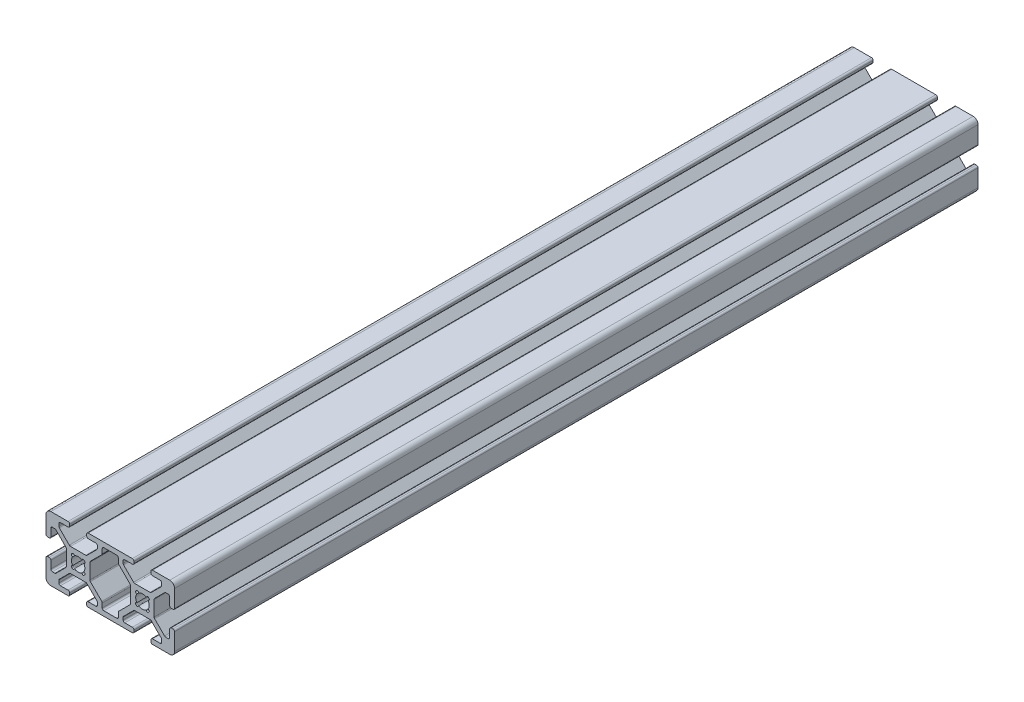
from build123d import *

# Parameters (mm, degrees)
BOSS_EXTRUDE1_DEPTH = 125


with BuildPart() as part:
    # Sketch1 → Boss-Extrude1 (new, symmetric)
    with BuildSketch(Plane.XY):
        with BuildLine():
            Line((-20, 8.5), (-20, 3.138))
            ThreePointArc((-20, 3.138), (-19.851210245, 2.778789755), (-19.492, 2.63))
            Line((-19.492, 2.63), (-19.008, 2.63))
            ThreePointArc((-19.008, 2.63), (-18.648789755, 2.778789755), (-18.5, 3.138))
            Line((-18.5, 3.138), (-18.5, 5.487))
            ThreePointArc((-18.5, 5.487), (-18.351210245, 5.846210245), (-17.992, 5.995))
            Line((-17.992, 5.995), (-17.266080661, 5.995))
            ThreePointArc((-17.266080661, 5.995), (-17.071677478, 5.956330803), (-16.906870417, 5.846210245))
            Line((-16.906870417, 5.846210245), (-13.803789755, 2.743129583))
            ThreePointArc((-13.803789755, 2.743129583), (-13.693669197, 2.578322522), (-13.655, 2.383919339))
            Line((-13.655, 2.383919339), (-13.655, -2.383919339))
            ThreePointArc((-13.655, -2.383919339), (-13.693669197, -2.578322522), (-13.803789755, -2.743129583))
            Line((-13.803789755, -2.743129583), (-16.906870417, -5.846210245))
            ThreePointArc((-16.906870417, -5.846210245), (-17.071677478, -5.956330803), (-17.266080661, -5.995))
            Line((-17.266080661, -5.995), (-17.992, -5.995))
            ThreePointArc((-17.992, -5.995), (-18.351210245, -5.846210245), (-18.5, -5.487))
            Line((-18.5, -5.487), (-18.5, -3.138))
            ThreePointArc((-18.5, -3.138), (-18.648789755, -2.778789755), (-19.008, -2.63))
            Line((-19.008, -2.63), (-19.492, -2.63))
            ThreePointArc((-19.492, -2.63), (-19.851210245, -2.778789755), (-20, -3.138))
            Line((-20, -3.138), (-20, -8.5))
            ThreePointArc((-20, -8.5), (-19.560660172, -9.560660172), (-18.5, -10))
            Line((-18.5, -10), (-13.138, -10))
            ThreePointArc((-13.138, -10), (-12.778789755, -9.851210245), (-12.63, -9.492))
            Line((-12.63, -9.492), (-12.63, -9.008))
            ThreePointArc((-12.63, -9.008), (-12.778789755, -8.648789755), (-13.138, -8.5))
            Line((-13.138, -8.5), (-15.487, -8.5))
            ThreePointArc((-15.487, -8.5), (-15.846210245, -8.351210245), (-15.995, -7.992))
            Line((-15.995, -7.992), (-15.995, -7.266080661))
            ThreePointArc((-15.995, -7.266080661), (-15.956330803, -7.071677478), (-15.846210245, -6.906870417))
            Line((-15.846210245, -6.906870417), (-12.743129583, -3.803789755))
            ThreePointArc((-12.743129583, -3.803789755), (-12.578322522, -3.693669197), (-12.383919339, -3.655))
            Line((-12.383919339, -3.655), (-7.616080661, -3.655))
            ThreePointArc((-7.616080661, -3.655), (-7.421677478, -3.693669197), (-7.256870417, -3.803789755))
            Line((-7.256870417, -3.803789755), (-4.153789755, -6.906870417))
            ThreePointArc((-4.153789755, -6.906870417), (-4.043669197, -7.071677478), (-4.005, -7.266080661))
            Line((-4.005, -7.266080661), (-4.005, -7.992))
            ThreePointArc((-4.005, -7.992), (-4.153789755, -8.351210245), (-4.513, -8.5))
            Line((-4.513, -8.5), (-6.862, -8.5))
            ThreePointArc((-6.862, -8.5), (-7.221210245, -8.648789755), (-7.37, -9.008))
            Line((-7.37, -9.008), (-7.37, -9.492))
            ThreePointArc((-7.37, -9.492), (-7.221210245, -9.851210245), (-6.862, -10))
            Line((-6.862, -10), (6.862, -10))
            ThreePointArc((6.862, -10), (7.221210245, -9.851210245), (7.37, -9.492))
            Line((7.37, -9.492), (7.37, -9.008))
            ThreePointArc((7.37, -9.008), (7.221210245, -8.648789755), (6.862, -8.5))
            Line((6.862, -8.5), (4.513, -8.5))
            ThreePointArc((4.513, -8.5), (4.153789755, -8.351210245), (4.005, -7.992))
            Line((4.005, -7.992), (4.005, -7.266080661))
            ThreePointArc((4.005, -7.266080661), (4.043669197, -7.071677478), (4.153789755, -6.906870417))
            Line((4.153789755, -6.906870417), (7.256870417, -3.803789755))
            ThreePointArc((7.256870417, -3.803789755), (7.421677478, -3.693669197), (7.616080661, -3.655))
            Line((7.616080661, -3.655), (12.383919339, -3.655))
            ThreePointArc((12.383919339, -3.655), (12.578322522, -3.693669197), (12.743129583, -3.803789755))
            Line((12.743129583, -3.803789755), (15.846210245, -6.906870417))
            ThreePointArc((15.846210245, -6.906870417), (15.956330803, -7.071677478), (15.995, -7.266080661))
            Line((15.995, -7.266080661), (15.995, -7.992))
            ThreePointArc((15.995, -7.992), (15.846210245, -8.351210245), (15.487, -8.5))
            Line((15.487, -8.5), (13.138, -8.5))
            ThreePointArc((13.138, -8.5), (12.778789755, -8.648789755), (12.63, -9.008))
            Line((12.63, -9.008), (12.63, -9.492))
            ThreePointArc((12.63, -9.492), (12.778789755, -9.851210245), (13.138, -10))
            Line((13.138, -10), (18.5, -10))
            ThreePointArc((18.5, -10), (19.560660172, -9.560660172), (20, -8.5))
            Line((20, -8.5), (20, -3.138))
            ThreePointArc((20, -3.138), (19.851210245, -2.778789755), (19.492, -2.63))
            Line((19.492, -2.63), (19.008, -2.63))
            ThreePointArc((19.008, -2.63), (18.648789755, -2.778789755), (18.5, -3.138))
            Line((18.5, -3.138), (18.5, -5.487))
            ThreePointArc((18.5, -5.487), (18.351210245, -5.846210245), (17.992, -5.995))
            Line((17.992, -5.995), (17.266080661, -5.995))
            ThreePointArc((17.266080661, -5.995), (17.071677478, -5.956330803), (16.906870417, -5.846210245))
            Line((16.906870417, -5.846210245), (13.803789755, -2.743129583))
            ThreePointArc((13.803789755, -2.743129583), (13.693669197, -2.578322522), (13.655, -2.383919339))
            Line((13.655, -2.383919339), (13.655, 2.383919339))
            ThreePointArc((13.655, 2.383919339), (13.693669197, 2.578322522), (13.803789755, 2.743129583))
            Line((13.803789755, 2.743129583), (16.906870417, 5.846210245))
            ThreePointArc((16.906870417, 5.846210245), (17.071677478, 5.956330803), (17.266080661, 5.995))
            Line((17.266080661, 5.995), (17.992, 5.995))
            ThreePointArc((17.992, 5.995), (18.351210245, 5.846210245), (18.5, 5.487))
            Line((18.5, 5.487), (18.5, 3.138))
            ThreePointArc((18.5, 3.138), (18.648789755, 2.778789755), (19.008, 2.63))
            Line((19.008, 2.63), (19.492, 2.63))
            ThreePointArc((19.492, 2.63), (19.851210245, 2.778789755), (20, 3.138))
            Line((20, 3.138), (20, 8.5))
            ThreePointArc((20, 8.5), (19.560660172, 9.560660172), (18.5, 10))
            Line((18.5, 10), (13.138, 10))
            ThreePointArc((13.138, 10), (12.778789755, 9.851210245), (12.63, 9.492))
            Line((12.63, 9.492), (12.63, 9.008))
            ThreePointArc((12.63, 9.008), (12.778789755, 8.648789755), (13.138, 8.5))
            Line((13.138, 8.5), (15.487, 8.5))
            ThreePointArc((15.487, 8.5), (15.846210245, 8.351210245), (15.995, 7.992))
            Line((15.995, 7.992), (15.995, 7.266080661))
            ThreePointArc((15.995, 7.266080661), (15.956330803, 7.071677478), (15.846210245, 6.906870417))
            Line((15.846210245, 6.906870417), (12.743129583, 3.803789755))
            ThreePointArc((12.743129583, 3.803789755), (12.578322522, 3.693669197), (12.383919339, 3.655))
            Line((12.383919339, 3.655), (7.616080661, 3.655))
            ThreePointArc((7.616080661, 3.655), (7.421677478, 3.693669197), (7.256870417, 3.803789755))
            Line((7.256870417, 3.803789755), (4.153789755, 6.906870417))
            ThreePointArc((4.153789755, 6.906870417), (4.043669197, 7.071677478), (4.005, 7.266080661))
            Line((4.005, 7.266080661), (4.005, 7.992))
            ThreePointArc((4.005, 7.992), (4.153789755, 8.351210245), (4.513, 8.5))
            Line((4.513, 8.5), (6.862, 8.5))
            ThreePointArc((6.862, 8.5), (7.221210245, 8.648789755), (7.37, 9.008))
            Line((7.37, 9.008), (7.37, 9.492))
            ThreePointArc((7.37, 9.492), (7.221210245, 9.851210245), (6.862, 10))
            Line((6.862, 10), (-6.862, 10))
            ThreePointArc((-6.862, 10), (-7.221210245, 9.851210245), (-7.37, 9.492))
            Line((-7.37, 9.492), (-7.37, 9.008))
            ThreePointArc((-7.37, 9.008), (-7.221210245, 8.648789755), (-6.862, 8.5))
            Line((-6.862, 8.5), (-4.513, 8.5))
            ThreePointArc((-4.513, 8.5), (-4.153789755, 8.351210245), (-4.005, 7.992))
            Line((-4.005, 7.992), (-4.005, 7.266080661))
            ThreePointArc((-4.005, 7.266080661), (-4.043669197, 7.071677478), (-4.153789755, 6.906870417))
            Line((-4.153789755, 6.906870417), (-7.256870417, 3.803789755))
            ThreePointArc((-7.256870417, 3.803789755), (-7.421677478, 3.693669197), (-7.616080661, 3.655))
            Line((-7.616080661, 3.655), (-12.383919339, 3.655))
            ThreePointArc((-12.383919339, 3.655), (-12.578322522, 3.693669197), (-12.743129583, 3.803789755))
            Line((-12.743129583, 3.803789755), (-15.846210245, 6.906870417))
            ThreePointArc((-15.846210245, 6.906870417), (-15.956330803, 7.071677478), (-15.995, 7.266080661))
            Line((-15.995, 7.266080661), (-15.995, 7.992))
            ThreePointArc((-15.995, 7.992), (-15.846210245, 8.351210245), (-15.487, 8.5))
            Line((-15.487, 8.5), (-13.138, 8.5))
            ThreePointArc((-13.138, 8.5), (-12.778789755, 8.648789755), (-12.63, 9.008))
            Line((-12.63, 9.008), (-12.63, 9.492))
            ThreePointArc((-12.63, 9.492), (-12.778789755, 9.851210245), (-13.138, 10))
            Line((-13.138, 10), (-18.5, 10))
            ThreePointArc((-18.5, 10), (-19.560660172, 9.560660172), (-20, 8.5))
        make_face()
        with BuildLine():
            Line((-12.028687234, 1.848687546), (-11.848687546, 2.028687234))
            ThreePointArc((-11.848687546, 2.028687234), (-11.412354366, 2.11078896), (-11.177278935, 1.734136762))
            ThreePointArc((-11.177278935, 1.734136762), (-10, 2.096), (-8.822721065, 1.734136762))
            ThreePointArc((-8.822721065, 1.734136762), (-8.587645634, 2.11078896), (-8.151312454, 2.028687234))
            Line((-8.151312454, 2.028687234), (-7.971312766, 1.848687546))
            ThreePointArc((-7.971312766, 1.848687546), (-7.88921104, 1.412354366), (-8.265863238, 1.177278935))
            ThreePointArc((-8.265863238, 1.177278935), (-7.904, 0), (-8.265863238, -1.177278935))
            ThreePointArc((-8.265863238, -1.177278935), (-7.88921104, -1.412354366), (-7.971312766, -1.848687546))
            Line((-7.971312766, -1.848687546), (-8.151312454, -2.028687234))
            ThreePointArc((-8.151312454, -2.028687234), (-8.587645634, -2.11078896), (-8.822721065, -1.734136762))
            ThreePointArc((-8.822721065, -1.734136762), (-10, -2.096), (-11.177278935, -1.734136762))
            ThreePointArc((-11.177278935, -1.734136762), (-11.412354366, -2.11078896), (-11.848687546, -2.028687234))
            Line((-11.848687546, -2.028687234), (-12.028687234, -1.848687546))
            ThreePointArc((-12.028687234, -1.848687546), (-12.11078896, -1.412354366), (-11.734136762, -1.177278935))
            ThreePointArc((-11.734136762, -1.177278935), (-12.096, 0), (-11.734136762, 1.177278935))
            ThreePointArc((-11.734136762, 1.177278935), (-12.11078896, 1.412354366), (-12.028687234, 1.848687546))
        make_face(mode=Mode.SUBTRACT)
        with BuildLine():
            Line((1.997, 8.5), (-1.997, 8.5))
            ThreePointArc((-1.997, 8.5), (-2.356210245, 8.351210245), (-2.505, 7.992))
            Line((-2.505, 7.992), (-2.505, 6.644760318))
            ThreePointArc((-2.505, 6.644760318), (-2.543669197, 6.450357134), (-2.653789755, 6.285550073))
            Line((-2.653789755, 6.285550073), (-6.196210245, 2.743129583))
            ThreePointArc((-6.196210245, 2.743129583), (-6.306330803, 2.578322522), (-6.345, 2.383919339))
            Line((-6.345, 2.383919339), (-6.345, -2.383919339))
            ThreePointArc((-6.345, -2.383919339), (-6.306330803, -2.578322522), (-6.196210245, -2.743129583))
            Line((-6.196210245, -2.743129583), (-2.653789755, -6.285550073))
            ThreePointArc((-2.653789755, -6.285550073), (-2.543669197, -6.450357134), (-2.505, -6.644760318))
            Line((-2.505, -6.644760318), (-2.505, -7.992))
            ThreePointArc((-2.505, -7.992), (-2.356210245, -8.351210245), (-1.997, -8.5))
            Line((-1.997, -8.5), (1.997, -8.5))
            ThreePointArc((1.997, -8.5), (2.356210245, -8.351210245), (2.505, -7.992))
            Line((2.505, -7.992), (2.505, -6.644760318))
            ThreePointArc((2.505, -6.644760318), (2.543669197, -6.450357134), (2.653789755, -6.285550073))
            Line((2.653789755, -6.285550073), (6.196210245, -2.743129583))
            ThreePointArc((6.196210245, -2.743129583), (6.306330803, -2.578322522), (6.345, -2.383919339))
            Line((6.345, -2.383919339), (6.345, 2.383919339))
            ThreePointArc((6.345, 2.383919339), (6.306330803, 2.578322522), (6.196210245, 2.743129583))
            Line((6.196210245, 2.743129583), (2.653789755, 6.285550073))
            ThreePointArc((2.653789755, 6.285550073), (2.543669197, 6.450357134), (2.505, 6.644760318))
            Line((2.505, 6.644760318), (2.505, 7.992))
            ThreePointArc((2.505, 7.992), (2.356210245, 8.351210245), (1.997, 8.5))
        make_face(mode=Mode.SUBTRACT)
        with BuildLine():
            Line((7.971312766, 1.848687546), (8.151312454, 2.028687234))
            ThreePointArc((8.151312454, 2.028687234), (8.587645634, 2.11078896), (8.822721065, 1.734136762))
            ThreePointArc((8.822721065, 1.734136762), (10, 2.096), (11.177278935, 1.734136762))
            ThreePointArc((11.177278935, 1.734136762), (11.412354366, 2.11078896), (11.848687546, 2.028687234))
            Line((11.848687546, 2.028687234), (12.028687234, 1.848687546))
            ThreePointArc((12.028687234, 1.848687546), (12.11078896, 1.412354366), (11.734136762, 1.177278935))
            ThreePointArc((11.734136762, 1.177278935), (12.096, 0), (11.734136762, -1.177278935))
            ThreePointArc((11.734136762, -1.177278935), (12.11078896, -1.412354366), (12.028687234, -1.848687546))
            Line((12.028687234, -1.848687546), (11.848687546, -2.028687234))
            ThreePointArc((11.848687546, -2.028687234), (11.412354366, -2.11078896), (11.177278935, -1.734136762))
            ThreePointArc((11.177278935, -1.734136762), (10, -2.096), (8.822721065, -1.734136762))
            ThreePointArc((8.822721065, -1.734136762), (8.587645634, -2.11078896), (8.151312454, -2.028687234))
            Line((8.151312454, -2.028687234), (7.971312766, -1.848687546))
            ThreePointArc((7.971312766, -1.848687546), (7.88921104, -1.412354366), (8.265863238, -1.177278935))
            ThreePointArc((8.265863238, -1.177278935), (7.904, 0), (8.265863238, 1.177278935))
            ThreePointArc((8.265863238, 1.177278935), (7.88921104, 1.412354366), (7.971312766, 1.848687546))
        make_face(mode=Mode.SUBTRACT)
    extrude(amount=BOSS_EXTRUDE1_DEPTH, both=True)


solid = part.part
